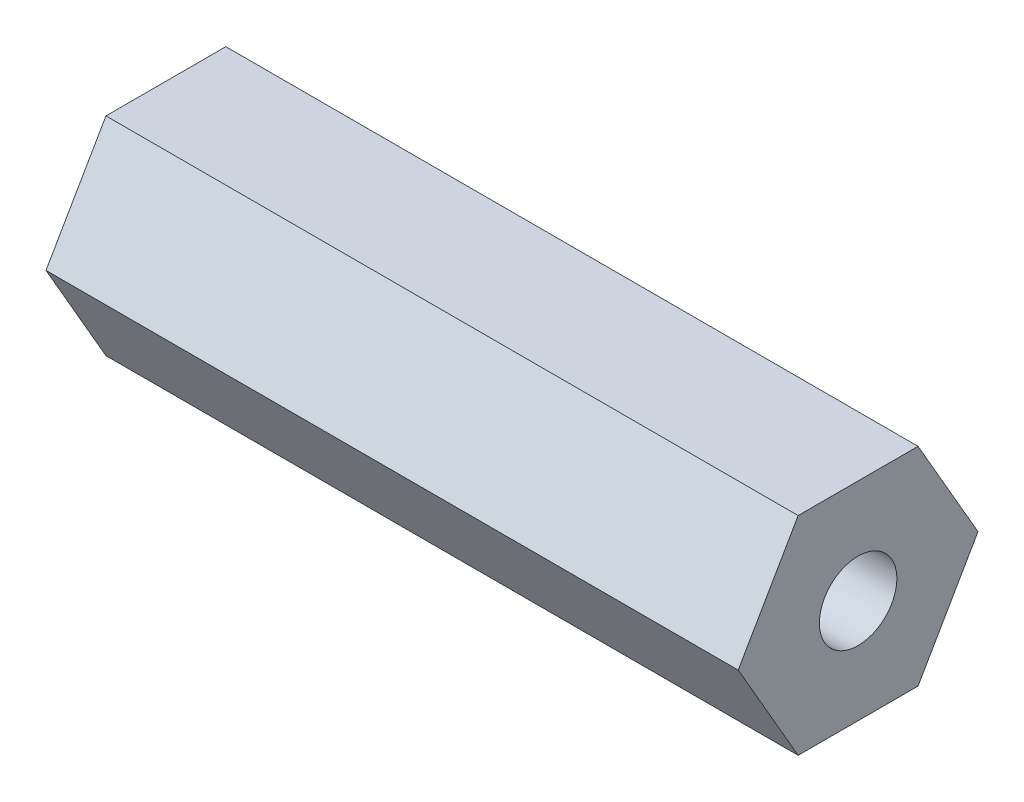
from build123d import *

# Parameters (mm, degrees)
BOSS_EXTRUDE1_DEPTH   = 15.875
F_2_56_TAPPED_HOLE1_D = 1.778


with BuildPart() as part:
    # Sketch1 → Boss-Extrude1 (new body)
    with BuildSketch(Plane(origin=(0, 0, 0), x_dir=(0, 0, -1), z_dir=(1, 0, 0))):
        Polygon((-1.374815329, -2.38125), (1.374815329, -2.38125), (2.749630657, 0), (1.374815329, 2.38125), (-1.374815329, 2.38125), (-2.749630657, 0), align=None)
    extrude(amount=BOSS_EXTRUDE1_DEPTH)

    # #2-56 Tapped Hole1 (through all)
    with Locations(Plane.ZY):
        with Locations((0, 0)):
            Hole(F_2_56_TAPPED_HOLE1_D / 2)


solid = part.part
